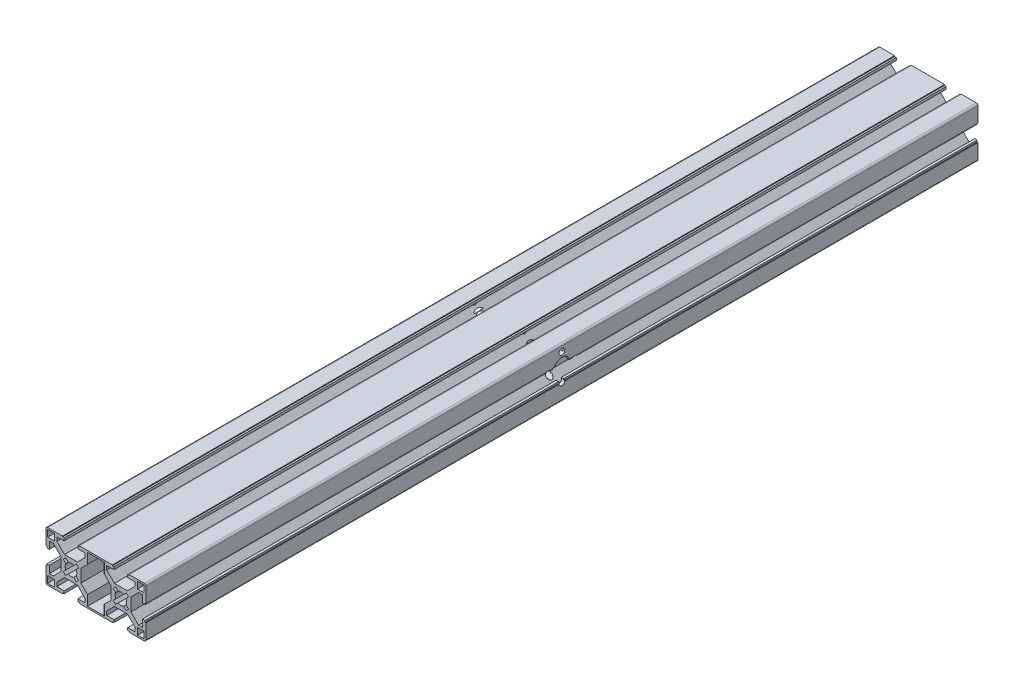
from build123d import *
from build123d.topology import SkipClean

# Parameters (mm, degrees)
ESBO_O1_W                      = 4
ESBO_O1_H                      = 4
RESSALTO_EXTRUS_O1_DEPTH       = 500
PADR_OCIRCULAR1_COUNT          = 4
PADR_O_LINEAR1_COUNT           = 2
PADR_O_LINEAR1_PITCH           = 30
PADR_O_LINEAR1_COPY_1_SKETCH_W = 4
PADR_O_LINEAR1_COPY_1_SKETCH_H = 4
PADR_O_LINEAR1_COPY_1_DEPTH    = 500
PADR_O_LINEAR1_COPY_2_SKETCH_W = 4
PADR_O_LINEAR1_COPY_2_SKETCH_H = 4
PADR_O_LINEAR1_COPY_2_DEPTH    = 500
PADR_O_LINEAR1_COPY_3_SKETCH_W = 4
PADR_O_LINEAR1_COPY_3_SKETCH_H = 4
PADR_O_LINEAR1_COPY_3_DEPTH    = 500
ESBO_O4_W                      = 10
ESBO_O4_H                      = 28
CORTE_EXTRUS_O1_DEPTH          = 503.244960154
FILETE1_R                      = 1
SKETCH1_R                      = 5.1
CUT_EXTRUDE1_DEPTH             = 10
SKETCH2_R                      = 4
SKETCH2_R_2                    = 1.75
CUT_EXTRUDE2_DEPTH             = 504.81048024


with BuildPart() as part:
    # Esboço1 → Ressalto-extrusão1 (new body)
    with BuildSketch(Plane.XY):
        with BuildLine():
            ThreePointArc((-1.664601464, 3.078815026), (-0.858529967, 3.393070335), (0, 3.5))
            Line((0, 3.5), (0, 6))
            Line((0, 6), (-3.878679656, 6))
            Line((-3.878679656, 6), (-8.5, 10.621320344))
            Line((-8.5, 10.621320344), (-8.5, 13))
            Line((-8.5, 13), (-4.1, 13))
            Line((-4.1, 13), (-4.1, 14.5))
            Line((-4.1, 14.5), (-5.1, 14.5))
            Line((-5.1, 14.5), (-5.1, 15))
            Line((-5.1, 15), (-15, 15))
            Line((-15, 15), (-15, 5.1))
            Line((-15, 5.1), (-14.5, 5.1))
            Line((-14.5, 5.1), (-14.5, 4.1))
            Line((-14.5, 4.1), (-13, 4.1))
            Line((-13, 4.1), (-13, 8.5))
            Line((-13, 8.5), (-10.621320344, 8.5))
            Line((-10.621320344, 8.5), (-6, 3.878679656))
            Line((-6, 3.878679656), (-6, 0))
            Line((-6, 0), (-3.5, 0))
            ThreePointArc((-3.5, 0), (-3.393070335, 0.858529967), (-3.078815026, 1.664601464))
            Line((-3.078815026, 1.664601464), (-4.596194078, 3.181980515))
            Line((-4.596194078, 3.181980515), (-3.181980515, 4.596194078))
            Line((-3.181980515, 4.596194078), (-1.664601464, 3.078815026))
        make_face()
        with Locations((-12, 12)):
            Rectangle(ESBO_O1_W, ESBO_O1_H, mode=Mode.SUBTRACT)
    ressalto_extrus_o1 = extrude(amount=RESSALTO_EXTRUS_O1_DEPTH)

    # PadrãoCircular1: Ressalto-extrusão1 ×4 about axis
    padr_ocircular1_axis = Axis((0, 0, 0), (0, 0, 1))
    for i in range(1, PADR_OCIRCULAR1_COUNT):
        add(ressalto_extrus_o1.rotate(padr_ocircular1_axis, i * 360 / PADR_OCIRCULAR1_COUNT))

    # Padrão linear1: Ressalto-extrusão1 ×2
    with Locations(*[(i * PADR_O_LINEAR1_PITCH, 0, 0) for i in range(1, PADR_O_LINEAR1_COUNT)]):
        add(ressalto_extrus_o1)

    # Padrão linear1 copy 1 sketch → Padrão linear1 copy 1 (add)
    with BuildSketch(Plane(origin=(30, 0, 0), x_dir=(0, 1, 0), z_dir=(0, 0, 1))):
        with BuildLine():
            ThreePointArc((-1.664601464, 3.078815026), (-0.858529967, 3.393070335), (0, 3.5))
            Line((0, 3.5), (0, 6))
            Line((0, 6), (-3.878679656, 6))
            Line((-3.878679656, 6), (-8.5, 10.621320344))
            Line((-8.5, 10.621320344), (-8.5, 13))
            Line((-8.5, 13), (-4.1, 13))
            Line((-4.1, 13), (-4.1, 14.5))
            Line((-4.1, 14.5), (-5.1, 14.5))
            Line((-5.1, 14.5), (-5.1, 15))
            Line((-5.1, 15), (-15, 15))
            Line((-15, 15), (-15, 5.1))
            Line((-15, 5.1), (-14.5, 5.1))
            Line((-14.5, 5.1), (-14.5, 4.1))
            Line((-14.5, 4.1), (-13, 4.1))
            Line((-13, 4.1), (-13, 8.5))
            Line((-13, 8.5), (-10.621320344, 8.5))
            Line((-10.621320344, 8.5), (-6, 3.878679656))
            Line((-6, 3.878679656), (-6, 0))
            Line((-6, 0), (-3.5, 0))
            ThreePointArc((-3.5, 0), (-3.393070335, 0.858529967), (-3.078815026, 1.664601464))
            Line((-3.078815026, 1.664601464), (-4.596194078, 3.181980515))
            Line((-4.596194078, 3.181980515), (-3.181980515, 4.596194078))
            Line((-3.181980515, 4.596194078), (-1.664601464, 3.078815026))
        make_face()
        with Locations((-12, 12)):
            Rectangle(PADR_O_LINEAR1_COPY_1_SKETCH_W, PADR_O_LINEAR1_COPY_1_SKETCH_H, mode=Mode.SUBTRACT)
    extrude(amount=PADR_O_LINEAR1_COPY_1_DEPTH)

    # Padrão linear1 copy 2 sketch → Padrão linear1 copy 2 (add)
    with BuildSketch(Plane(origin=(30, 0, 0), x_dir=(-1, 0, 0), z_dir=(0, 0, 1))):
        with BuildLine():
            ThreePointArc((-1.664601464, 3.078815026), (-0.858529967, 3.393070335), (0, 3.5))
            Line((0, 3.5), (0, 6))
            Line((0, 6), (-3.878679656, 6))
            Line((-3.878679656, 6), (-8.5, 10.621320344))
            Line((-8.5, 10.621320344), (-8.5, 13))
            Line((-8.5, 13), (-4.1, 13))
            Line((-4.1, 13), (-4.1, 14.5))
            Line((-4.1, 14.5), (-5.1, 14.5))
            Line((-5.1, 14.5), (-5.1, 15))
            Line((-5.1, 15), (-15, 15))
            Line((-15, 15), (-15, 5.1))
            Line((-15, 5.1), (-14.5, 5.1))
            Line((-14.5, 5.1), (-14.5, 4.1))
            Line((-14.5, 4.1), (-13, 4.1))
            Line((-13, 4.1), (-13, 8.5))
            Line((-13, 8.5), (-10.621320344, 8.5))
            Line((-10.621320344, 8.5), (-6, 3.878679656))
            Line((-6, 3.878679656), (-6, 0))
            Line((-6, 0), (-3.5, 0))
            ThreePointArc((-3.5, 0), (-3.393070335, 0.858529967), (-3.078815026, 1.664601464))
            Line((-3.078815026, 1.664601464), (-4.596194078, 3.181980515))
            Line((-4.596194078, 3.181980515), (-3.181980515, 4.596194078))
            Line((-3.181980515, 4.596194078), (-1.664601464, 3.078815026))
        make_face()
        with Locations((-12, 12)):
            Rectangle(PADR_O_LINEAR1_COPY_2_SKETCH_W, PADR_O_LINEAR1_COPY_2_SKETCH_H, mode=Mode.SUBTRACT)
    extrude(amount=PADR_O_LINEAR1_COPY_2_DEPTH)

    # Padrão linear1 copy 3 sketch → Padrão linear1 copy 3 (add)
    with BuildSketch(Plane(origin=(30, 0, 0), x_dir=(0, -1, 0), z_dir=(0, 0, 1))):
        with BuildLine():
            ThreePointArc((-1.664601464, 3.078815026), (-0.858529967, 3.393070335), (0, 3.5))
            Line((0, 3.5), (0, 6))
            Line((0, 6), (-3.878679656, 6))
            Line((-3.878679656, 6), (-8.5, 10.621320344))
            Line((-8.5, 10.621320344), (-8.5, 13))
            Line((-8.5, 13), (-4.1, 13))
            Line((-4.1, 13), (-4.1, 14.5))
            Line((-4.1, 14.5), (-5.1, 14.5))
            Line((-5.1, 14.5), (-5.1, 15))
            Line((-5.1, 15), (-15, 15))
            Line((-15, 15), (-15, 5.1))
            Line((-15, 5.1), (-14.5, 5.1))
            Line((-14.5, 5.1), (-14.5, 4.1))
            Line((-14.5, 4.1), (-13, 4.1))
            Line((-13, 4.1), (-13, 8.5))
            Line((-13, 8.5), (-10.621320344, 8.5))
            Line((-10.621320344, 8.5), (-6, 3.878679656))
            Line((-6, 3.878679656), (-6, 0))
            Line((-6, 0), (-3.5, 0))
            ThreePointArc((-3.5, 0), (-3.393070335, 0.858529967), (-3.078815026, 1.664601464))
            Line((-3.078815026, 1.664601464), (-4.596194078, 3.181980515))
            Line((-4.596194078, 3.181980515), (-3.181980515, 4.596194078))
            Line((-3.181980515, 4.596194078), (-1.664601464, 3.078815026))
        make_face()
        with Locations((-12, 12)):
            Rectangle(PADR_O_LINEAR1_COPY_3_SKETCH_W, PADR_O_LINEAR1_COPY_3_SKETCH_H, mode=Mode.SUBTRACT)
    extrude(amount=PADR_O_LINEAR1_COPY_3_DEPTH)

    # Esboço4 → Corte-extrusão1 (cut, through all)
    with BuildSketch(Plane(origin=(0, 0, 0), x_dir=(-1, 0, 0), z_dir=(0, 0, -1))):
        with Locations((-15, 0)):
            Rectangle(ESBO_O4_W, ESBO_O4_H)
    extrude(amount=-CORTE_EXTRUS_O1_DEPTH, mode=Mode.SUBTRACT)

    # Filete1
    filete1_edges = [part.edges().sort_by_distance(p)[0] for p in [
        (45, -15, 250),
        (45, 15, 250),
        (-15, 15, 250),
        (-15, -15, 250),
    ]]
    fillet(filete1_edges, radius=FILETE1_R)

    # Sketch1 → Cut-Extrude1 (cut)
    with BuildSketch(Plane.ZY.offset(15)):
        with Locations(Location((250, 3, 0), (0, 0, 170.079001247))):
            Circle(SKETCH1_R)
    cut_extrude1 = extrude(amount=-CUT_EXTRUDE1_DEPTH, mode=Mode.SUBTRACT)

    # Mirror1: Cut-Extrude1 across plane
    add(cut_extrude1.mirror(Plane.ZY.offset(-15)), mode=Mode.SUBTRACT)

    # Sketch2 → Cut-Extrude2 (cut, through all)
    with SkipClean():  # the faces are left unmerged after this step: merging them gives an invalid solid
        with BuildSketch(Plane.ZY.offset(15)):
            with Locations(Location((250, 3, 0), (0, 0, 12.689646209))):
                Circle(SKETCH2_R)
            with Locations(Location((250, 11, 0), (0, 0, 270))):
                Circle(SKETCH2_R_2)
            with Locations(Location((258, 3, 0), (0, 0, 149.860791305))):
                Circle(SKETCH2_R_2)
            with Locations(Location((250, -5, 0), (0, 0, 140.151897643))):
                Circle(SKETCH2_R_2)
            with Locations(Location((242, 3, 0), (0, 0, 30.139208695))):
                Circle(SKETCH2_R_2)
        extrude(amount=-CUT_EXTRUDE2_DEPTH, mode=Mode.SUBTRACT)


solid = part.part
